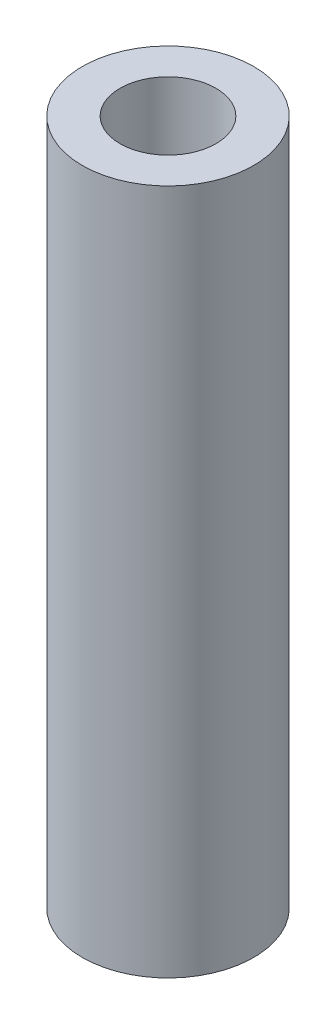
from build123d import *

# Parameters (mm, degrees)
SKETCH1_R           = 3.175
SKETCH1_R_2         = 1.778
BOSS_EXTRUDE1_DEPTH = 25.4


with BuildPart() as part:
    # Sketch1 → Boss-Extrude1 (new body)
    with BuildSketch(Plane(origin=(0, 0, 0), x_dir=(1, 0, 0), z_dir=(0, 1, 0))):
        with Locations(Location((0, 0, 0), (0, 0, 270))):
            Circle(SKETCH1_R)
        with Locations(Location((0, 0, 0), (0, 0, 270))):
            Circle(SKETCH1_R_2, mode=Mode.SUBTRACT)
    extrude(amount=BOSS_EXTRUDE1_DEPTH)


solid = part.part
